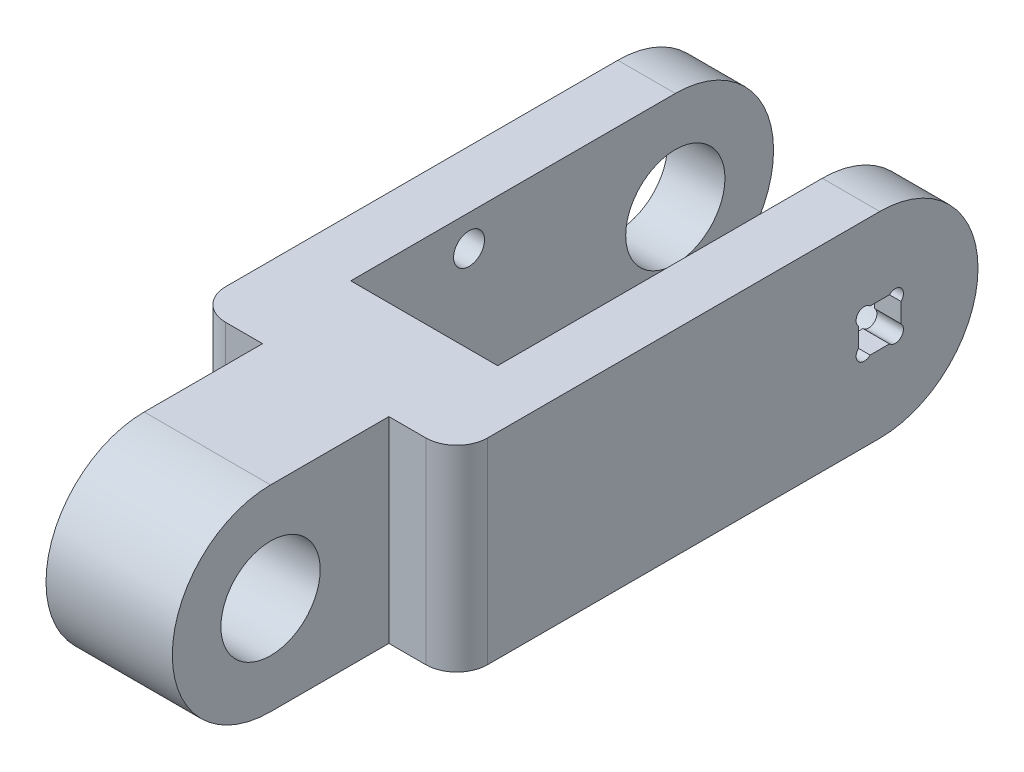
from build123d import *

# Parameters (mm, degrees)
BOSS_EXTRUDE1_DEPTH = 50.8
SKETCH2_W           = 28.5
SKETCH2_H           = 19.05
SKETCH2_H_2         = 62.95
SKETCH2_W_2         = 13.15
SKETCH2_H_3         = 42
CUT_EXTRUDE2_DEPTH  = 150
SKETCH8_R           = 9.625
CUT_EXTRUDE8_DEPTH  = 90.793902911
SKETCH11_R          = 9.625
SKETCH11_W          = 8.25
SKETCH11_H          = 8.25
BOSS_EXTRUDE4_DEPTH = 5.15
FILLET1_R           = 6
CUT_EXTRUDE10_START = -5.15
SKETCH14_R          = 1.5875
CUT_EXTRUDE10_DEPTH = 5.15
CUT_EXTRUDE16_REACH = 91.794
SKETCH21_R          = 3


with BuildPart() as part:
    # Sketch1 → Boss-Extrude1 (new body)
    with BuildSketch(Plane(origin=(0, 0, 0), x_dir=(0, 0, -1), z_dir=(1, 0, 0))):
        with BuildLine():
            Line((-52.5, 19.05), (52.5, 19.05))
            ThreePointArc((52.5, 19.05), (71.55, 0), (52.5, -19.05))
            Line((52.5, -19.05), (-52.5, -19.05))
            ThreePointArc((-52.5, -19.05), (-71.55, 0), (-52.5, 19.05))
        make_face()
    extrude(amount=BOSS_EXTRUDE1_DEPTH)

    # Sketch2 → Cut-Extrude2 (cut)
    with BuildSketch(Plane(origin=(0, 19.05, 0), x_dir=(1, 0, 0), z_dir=(0, 1, 0))):
        with Locations((25.4, 62.025)):
            Rectangle(SKETCH2_W, SKETCH2_H)
        with Locations((25.4, 21.025)):
            Rectangle(SKETCH2_W, SKETCH2_H_2)
        with Locations((44.225, -50.55)):
            Rectangle(SKETCH2_W_2, SKETCH2_H_3)
        with Locations((6.575, -50.55)):
            Rectangle(SKETCH2_W_2, SKETCH2_H_3)
    extrude(amount=-CUT_EXTRUDE2_DEPTH, mode=Mode.SUBTRACT)

    # Sketch8 → Cut-Extrude8 (cut, through all)
    with BuildSketch(Plane(origin=(50.8, 0, 0), x_dir=(0, 0, -1), z_dir=(1, 0, 0))):
        with Locations((-52.5, 0)):
            Circle(SKETCH8_R)
        with Locations((52.5, 0)):
            Circle(SKETCH8_R)
    extrude(amount=-CUT_EXTRUDE8_DEPTH, mode=Mode.SUBTRACT)

    # Sketch11 → Boss-Extrude4 (add)
    with BuildSketch(Plane(origin=(50.8, 0, 0), x_dir=(0, 0, -1), z_dir=(1, 0, 0))):
        with Locations((52.5, 0)):
            Circle(SKETCH11_R)
        with Locations((52.5, 0)):
            Rectangle(SKETCH11_W, SKETCH11_H, mode=Mode.SUBTRACT)
    extrude(amount=-BOSS_EXTRUDE4_DEPTH)

    # Fillet1
    fillet1_edges = [part.edges().sort_by_distance(p)[0] for p in [
        (50.8, 0, 29.55),
        (0, 0, 29.55),
    ]]
    fillet(fillet1_edges, radius=FILLET1_R)

    # Sketch14 → Cut-Extrude10 (cut)
    with BuildSketch(Plane(origin=(50.8, 0, 0), x_dir=(0, 0, -1), z_dir=(1, 0, 0)).offset(CUT_EXTRUDE10_START)):
        with Locations((49.497532015, 3.002467985)):
            Circle(SKETCH14_R)
        with Locations((55.502467985, 3.002467985)):
            Circle(SKETCH14_R)
        with Locations((55.502467985, -3.002467985)):
            Circle(SKETCH14_R)
        with Locations((49.497532015, -3.002467985)):
            Circle(SKETCH14_R)
    extrude(amount=CUT_EXTRUDE10_DEPTH, mode=Mode.SUBTRACT)

    # Sketch21 → Cut-Extrude16 (cut, up to next)
    with BuildSketch(Plane.ZY, mode=Mode.PRIVATE) as cut_extrude16_sk1:
        with Locations((-12.5, 13)):
            Circle(SKETCH21_R)
    cut_extrude16_tool1 = extrude(cut_extrude16_sk1.sketch, amount=-CUT_EXTRUDE16_REACH, mode=Mode.PRIVATE) & part.part
    # Sketch21 → Cut-Extrude16 (cut, up to next)
    with BuildSketch(Plane.ZY, mode=Mode.PRIVATE) as cut_extrude16_sk2:
        with Locations((-12.5, -13)):
            Circle(SKETCH21_R)
    cut_extrude16_tool2 = extrude(cut_extrude16_sk2.sketch, amount=-CUT_EXTRUDE16_REACH, mode=Mode.PRIVATE) & part.part
    add(cut_extrude16_tool1.solids().sort_by_distance((0, 13, -12.5))[0], mode=Mode.SUBTRACT)
    add(cut_extrude16_tool2.solids().sort_by_distance((0, -13, -12.5))[0], mode=Mode.SUBTRACT)


solid = part.part
